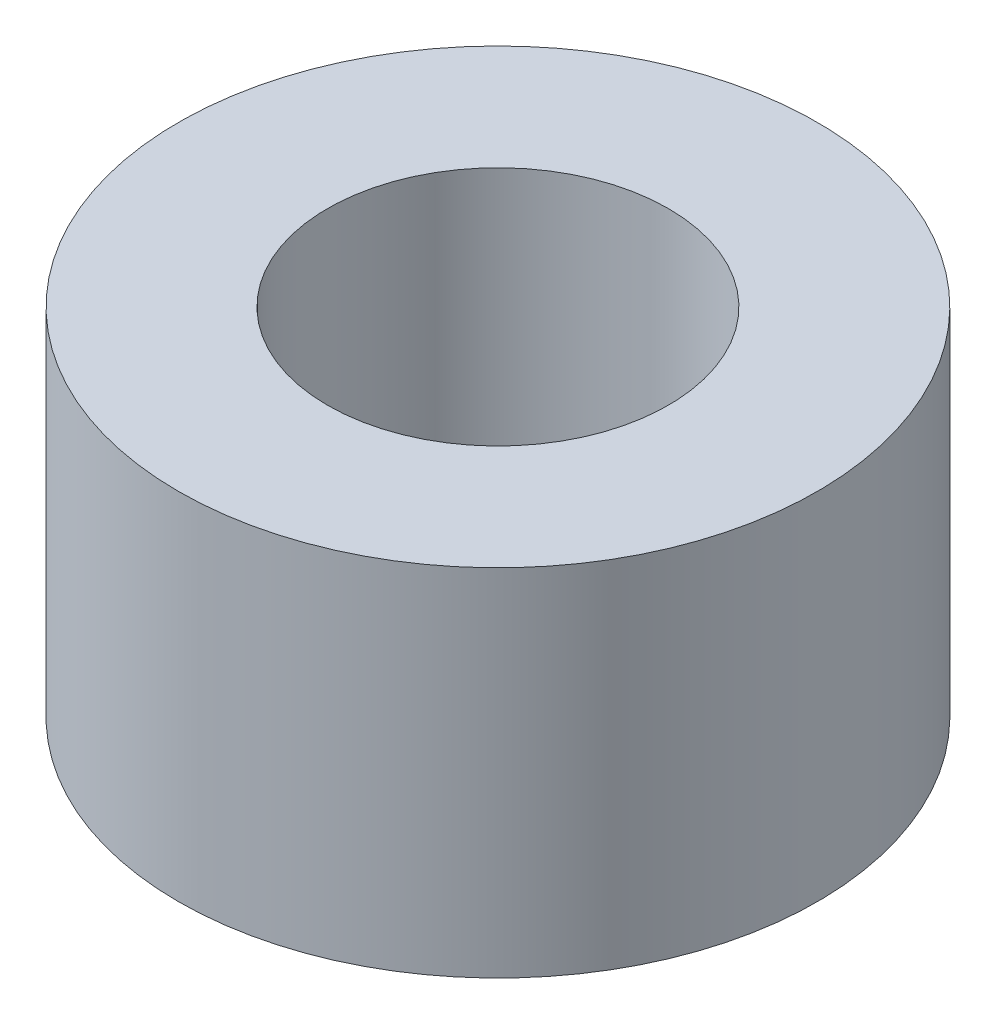
from build123d import *

# Parameters (mm, degrees)
SKETCH_1_R          = 7.5
EXTRUDE_1_DEPTH     = 8.34
SKETCH_3_R          = 4
CUT_EXTRUDE_1_DEPTH = 21.36


with BuildPart() as part:
    # 스케치1 → 보스-돌출1 (new body)
    with BuildSketch(Plane(origin=(0, 0, 0), x_dir=(1, 0, 0), z_dir=(0, 1, 0))):
        with Locations(Location((0, 0, 0), (0, 0, 270))):
            Circle(SKETCH_1_R)
    extrude(amount=-EXTRUDE_1_DEPTH)

    # 스케치3 → 컷-돌출1 (cut)
    with BuildSketch(Plane(origin=(0, 0, 0), x_dir=(1, 0, 0), z_dir=(0, 1, 0))):
        with Locations(Location((0, 0, 0), (0, 0, 270))):
            Circle(SKETCH_3_R)
    extrude(amount=-CUT_EXTRUDE_1_DEPTH, mode=Mode.SUBTRACT)


solid = part.part
